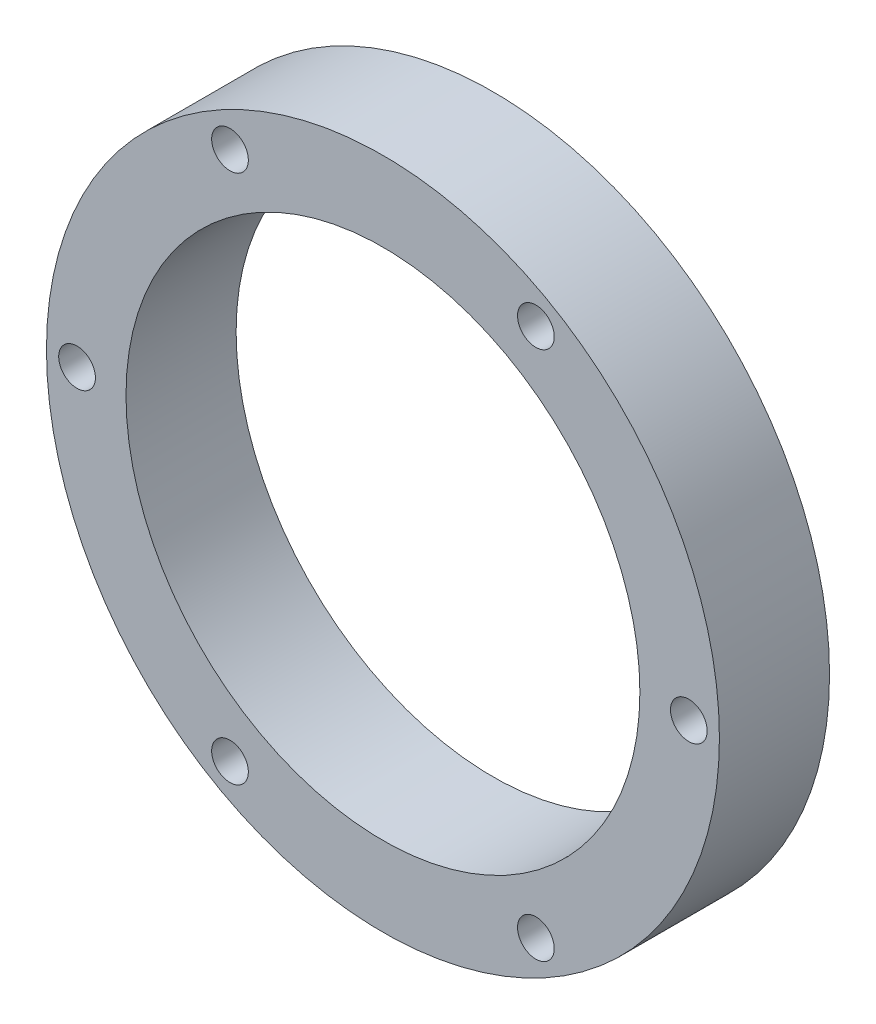
from build123d import *

# Parameters (mm, degrees)
SKETCH1_R           = 27.5
SKETCH1_R_2         = 21
SKETCH1_R_3         = 1.5
BOSS_EXTRUDE1_DEPTH = 9


with BuildPart() as part:
    # Sketch1 → Boss-Extrude1 (new body)
    with BuildSketch(Plane.XY):
        Circle(SKETCH1_R)
        Circle(SKETCH1_R_2, mode=Mode.SUBTRACT)
        with Locations((-12.5, 21.650635095)):
            Circle(SKETCH1_R_3, mode=Mode.SUBTRACT)
        with Locations((-25, 0)):
            Circle(SKETCH1_R_3, mode=Mode.SUBTRACT)
        with Locations((-12.5, -21.650635095)):
            Circle(SKETCH1_R_3, mode=Mode.SUBTRACT)
        with Locations((12.5, -21.650635095)):
            Circle(SKETCH1_R_3, mode=Mode.SUBTRACT)
        with Locations((25, 0)):
            Circle(SKETCH1_R_3, mode=Mode.SUBTRACT)
        with Locations((12.5, 21.650635095)):
            Circle(SKETCH1_R_3, mode=Mode.SUBTRACT)
    extrude(amount=BOSS_EXTRUDE1_DEPTH)


solid = part.part
